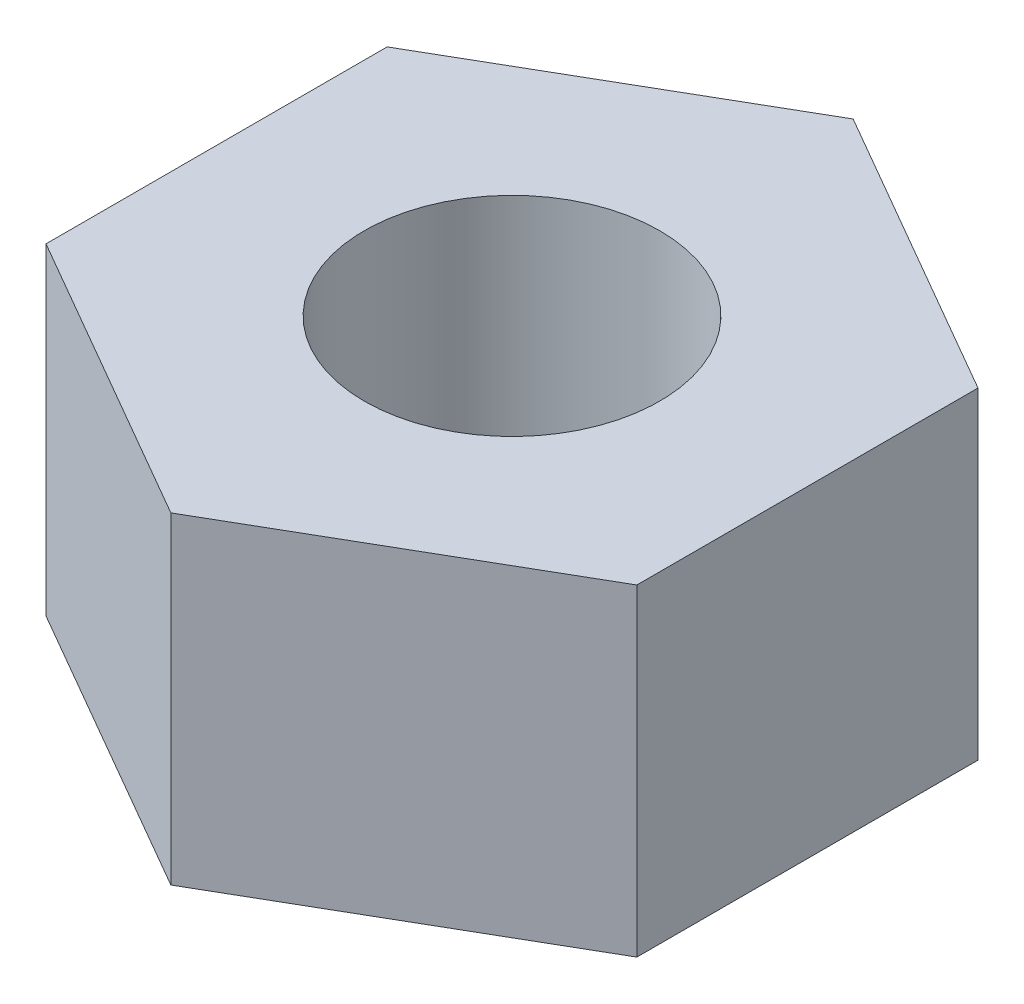
from build123d import *

# Parameters (mm, degrees)
SKETCH1_R           = 1.375
BOSS_EXTRUDE1_DEPTH = 3


with BuildPart() as part:
    # Sketch1 → Boss-Extrude1 (new body)
    with BuildSketch(Plane(origin=(0, 0, 0), x_dir=(1, 0, 0), z_dir=(0, 1, 0))):
        Polygon((0, 3.175426481), (-2.75, 1.58771324), (-2.75, -1.58771324), (0, -3.175426481), (2.75, -1.58771324), (2.75, 1.58771324), align=None)
        with Locations(Location((0, 0, 0), (0, 0, 270))):
            Circle(SKETCH1_R, mode=Mode.SUBTRACT)
    extrude(amount=BOSS_EXTRUDE1_DEPTH)


solid = part.part
